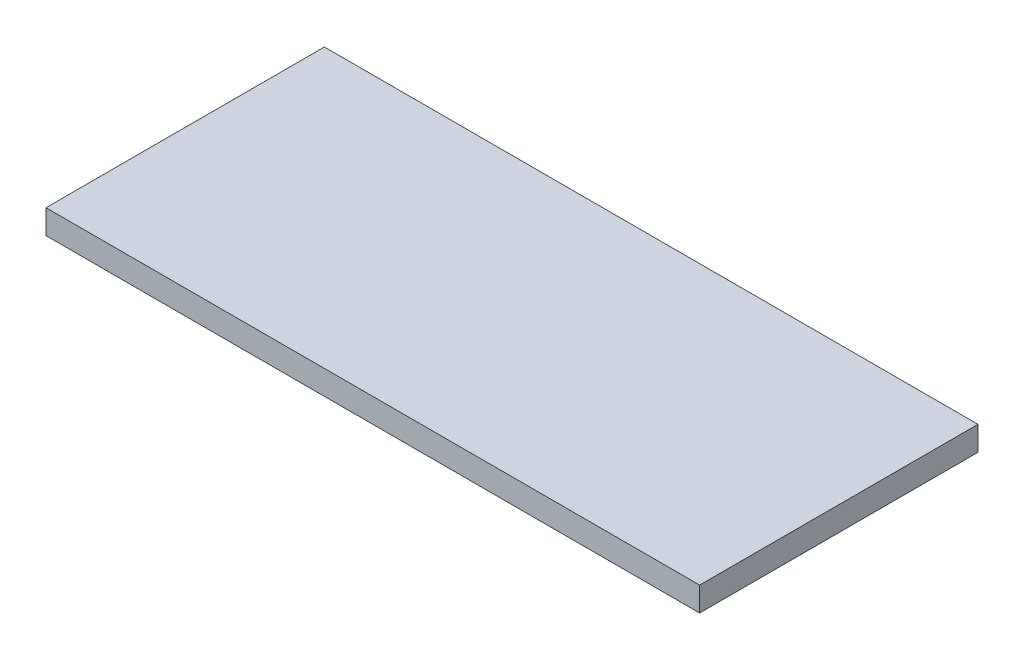
from build123d import *

# Parameters (mm, degrees)
SKETCH_1_W      = 54
SKETCH_1_H      = 23
EXTRUDE_1_DEPTH = 2


with BuildPart() as part:
    # 草图1 → 凸台-拉伸1 (new body)
    with BuildSketch(Plane(origin=(0, 0, 0), x_dir=(1, 0, 0), z_dir=(0, 1, 0))):
        Rectangle(SKETCH_1_W, SKETCH_1_H)
    extrude(amount=EXTRUDE_1_DEPTH)


solid = part.part
